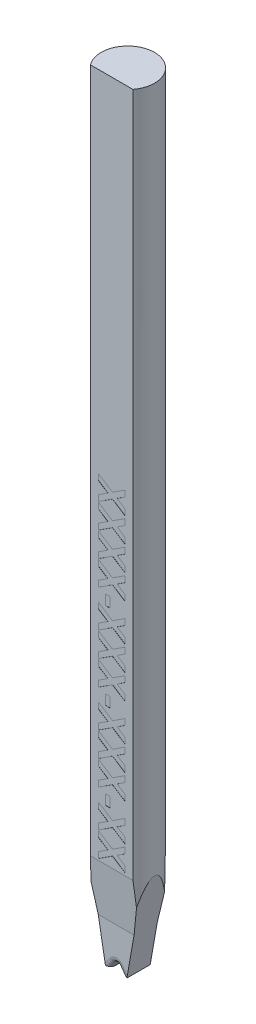
from build123d import *

# Parameters (mm, degrees)
SKETCH_TL_CUTTING_R       = 0.99695
TL_CUTTING_DEPTH          = 29.0068
SKETCH_TDF_GRINDING_W     = 2.0139
SKETCH_TDF_GRINDING_H     = 2.0139
TDF_GRINDING_DEPTH        = 30.041044486
SKETCH_ENGRAVING_W        = 0.166666667
SKETCH_ENGRAVING_H        = 0.371794872
ENGRAVING_DEPTH           = 0.005
VW_VR_GRINDING_DEPTH      = 1.00695
VW_VR_GRINDING_DEPTH_BACK = 1.00695
ISA_GRINDING_DEPTH        = 1.00695
ISA_GRINDING_DEPTH_BACK   = 1.00695
PRE_FRX_BRX_DEPTH         = 1.00695
PRE_FRX_BRX_DEPTH_BACK    = 1.00695
SKETCH_PRE_FRX_BRX_W      = 0.57134
SKETCH_PRE_FRX_BRX_H      = 1.524
FR_EDM_R                  = 0.20066
BR_EDM_R                  = 0.20066
FA_BA_GRINDING_DEPTH      = 1.00695
FA_BA_GRINDING_DEPTH_BACK = 1.00695


with BuildPart() as part:
    # sketch_TL_cutting → TL_cutting (new body)
    with BuildSketch(Plane(origin=(0, 0, 0), x_dir=(1, 0, 0), z_dir=(0, 1, 0))):
        with Locations(Location((0, 0, 0), (0, 0, 270))):
            Circle(SKETCH_TL_CUTTING_R)
    extrude(amount=TL_CUTTING_DEPTH)

    # sketch_TDF_grinding → TDF_grinding (cut, through all)
    with BuildSketch(Plane(origin=(0, 0, 0), x_dir=(1, 0, 0), z_dir=(0, 1, 0))):
        with Locations((0, -1.6102)):
            Rectangle(SKETCH_TDF_GRINDING_W, SKETCH_TDF_GRINDING_H)
    extrude(amount=TDF_GRINDING_DEPTH, mode=Mode.SUBTRACT)

    # sketch_engraving → engraving (cut)
    with BuildSketch(Plane.XY.offset(0.60325)):
        Polygon((-0.5, 15.947329744), (0.029647436, 15.604581346), (0.5, 15.908868205), (0.5, 15.68410859), (0.203325321, 15.492201538), (0.5, 15.300294487), (0.5, 15.075534872), (0.029647436, 15.379821731), (-0.5, 15.037073333), (-0.5, 15.261832949), (-0.144030449, 15.492201538), (-0.5, 15.722570128), align=None)
        Polygon((-0.5, 15.024252821), (0.029647436, 14.681504423), (0.5, 14.985791282), (0.5, 14.761031667), (0.203325321, 14.569124615), (0.5, 14.377217564), (0.5, 14.152457949), (0.029647436, 14.456744808), (-0.5, 14.11399641), (-0.5, 14.338756026), (-0.144030449, 14.569124615), (-0.5, 14.799493205), align=None)
        Polygon((-0.5, 14.101175897), (0.029647436, 13.7584275), (0.5, 14.062714359), (0.5, 13.837954744), (0.203325321, 13.646047692), (0.5, 13.454140641), (0.5, 13.229381026), (0.029647436, 13.533667885), (-0.5, 13.190919487), (-0.5, 13.415679103), (-0.144030449, 13.646047692), (-0.5, 13.876416282), align=None)
        Polygon((-0.5, 13.178098974), (0.029647436, 12.835350577), (0.5, 13.139637436), (0.5, 12.914877821), (0.203325321, 12.722970769), (0.5, 12.531063718), (0.5, 12.306304103), (0.029647436, 12.610590962), (-0.5, 12.267842564), (-0.5, 12.492602179), (-0.144030449, 12.722970769), (-0.5, 12.953339359), align=None)
        with Locations((-0.147435898, 11.998611795)):
            Rectangle(SKETCH_ENGRAVING_W, SKETCH_ENGRAVING_H)
        Polygon((-0.5, 11.79348359), (0.029647436, 11.450735192), (0.5, 11.755022051), (0.5, 11.530262436), (0.203325321, 11.338355385), (0.5, 11.146448333), (0.5, 10.921688718), (0.029647436, 11.225975577), (-0.5, 10.883227179), (-0.5, 11.107986795), (-0.144030449, 11.338355385), (-0.5, 11.568723974), align=None)
        Polygon((-0.5, 10.870406667), (0.029647436, 10.527658269), (0.5, 10.831945128), (0.5, 10.607185513), (0.203325321, 10.415278462), (0.5, 10.22337141), (0.5, 9.998611795), (0.029647436, 10.302898654), (-0.5, 9.960150256), (-0.5, 10.184909872), (-0.144030449, 10.415278462), (-0.5, 10.645647051), align=None)
        Polygon((-0.5, 9.947329744), (0.029647436, 9.604581346), (0.5, 9.908868205), (0.5, 9.68410859), (0.203325321, 9.492201538), (0.5, 9.300294487), (0.5, 9.075534872), (0.029647436, 9.379821731), (-0.5, 9.037073333), (-0.5, 9.261832949), (-0.144030449, 9.492201538), (-0.5, 9.722570128), align=None)
        with Locations((-0.147435898, 8.767842564)):
            Rectangle(SKETCH_ENGRAVING_W, SKETCH_ENGRAVING_H)
        Polygon((-0.5, 8.562714359), (0.029647436, 8.219965962), (0.5, 8.524252821), (0.5, 8.299493205), (0.203325321, 8.107586154), (0.5, 7.915679103), (0.5, 7.690919487), (0.029647436, 7.995206346), (-0.5, 7.652457949), (-0.5, 7.877217564), (-0.144030449, 8.107586154), (-0.5, 8.337954744), align=None)
        Polygon((-0.5, 7.639637436), (0.029647436, 7.296889038), (0.5, 7.601175897), (0.5, 7.376416282), (0.203325321, 7.184509231), (0.5, 6.992602179), (0.5, 6.767842564), (0.029647436, 7.072129423), (-0.5, 6.729381026), (-0.5, 6.954140641), (-0.144030449, 7.184509231), (-0.5, 7.414877821), align=None)
        Polygon((-0.5, 6.716560513), (0.029647436, 6.373812115), (0.5, 6.678098974), (0.5, 6.453339359), (0.203325321, 6.261432308), (0.5, 6.069525256), (0.5, 5.844765641), (0.029647436, 6.1490525), (-0.5, 5.806304103), (-0.5, 6.031063718), (-0.144030449, 6.261432308), (-0.5, 6.491800897), align=None)
        with Locations((-0.147435898, 5.537073333)):
            Rectangle(SKETCH_ENGRAVING_W, SKETCH_ENGRAVING_H)
        Polygon((-0.5, 5.331945128), (0.029647436, 4.989196731), (0.5, 5.29348359), (0.5, 5.068723974), (0.203325321, 4.876816923), (0.5, 4.684909872), (0.5, 4.460150256), (0.029647436, 4.764437115), (-0.5, 4.421688718), (-0.5, 4.646448333), (-0.144030449, 4.876816923), (-0.5, 5.107185513), align=None)
        Polygon((-0.5, 4.408868205), (0.029647436, 4.066119808), (0.5, 4.370406667), (0.5, 4.145647051), (0.203325321, 3.95374), (0.5, 3.761832949), (0.5, 3.537073333), (0.029647436, 3.841360192), (-0.5, 3.498611795), (-0.5, 3.72337141), (-0.144030449, 3.95374), (-0.5, 4.18410859), align=None)
    extrude(amount=-ENGRAVING_DEPTH, mode=Mode.SUBTRACT)

    # sketch_VW_VR_grinding → VW_VR_grinding (cut, two sides: drawn at the far end of the back side and taken through both)
    with BuildSketch(Plane.XY.offset(-VW_VR_GRINDING_DEPTH_BACK)):
        with BuildLine():
            Line((-0.99195, -0.01), (-0.99195, 1.509))
            ThreePointArc((-0.99195, 1.509), (-0.993414466, 1.512535534), (-0.99695, 1.514))
            Line((-0.99695, 1.514), (-1.00695, 1.514))
            Line((-1.00695, 1.514), (-1.00695, -0.01))
            Line((-1.00695, -0.01), (-0.99195, -0.01))
        make_face()
        with BuildLine():
            Line((0.99195, -0.01), (0.99195, 1.509))
            ThreePointArc((0.99195, 1.509), (0.993414466, 1.512535534), (0.99695, 1.514))
            Line((0.99695, 1.514), (1.00695, 1.514))
            Line((1.00695, 1.514), (1.00695, -0.01))
            Line((1.00695, -0.01), (0.99195, -0.01))
        make_face()
    extrude(amount=VW_VR_GRINDING_DEPTH + VW_VR_GRINDING_DEPTH_BACK, mode=Mode.SUBTRACT)

    # sketch_ISA_grinding → ISA_grinding (cut, two sides: drawn at the far end of the back side and taken through both)
    with BuildSketch(Plane.XY.offset(-ISA_GRINDING_DEPTH_BACK)):
        Polygon((-0.40005, 0), (-1.00695, 3.441900936), (-1.00695, -0.01), (1.00695, -0.01), (1.00695, 3.441900936), (0.40005, 0), align=None)
    extrude(amount=ISA_GRINDING_DEPTH + ISA_GRINDING_DEPTH_BACK, mode=Mode.SUBTRACT)

    # sketch_pre_FRX_BRX → pre_FRX_BRX (cut, two sides: drawn at the far end of the back side and taken through both)
    with BuildSketch(Plane(origin=(0, 0, 0), x_dir=(0, 0, -1), z_dir=(1, 0, 0)).offset(-PRE_FRX_BRX_DEPTH_BACK)):
        with Locations((-0.72128, 0.752)):
            Rectangle(SKETCH_PRE_FRX_BRX_W, SKETCH_PRE_FRX_BRX_H)
        with Locations((0.72128, 0.752)):
            Rectangle(SKETCH_PRE_FRX_BRX_W, SKETCH_PRE_FRX_BRX_H)
    extrude(amount=PRE_FRX_BRX_DEPTH + PRE_FRX_BRX_DEPTH_BACK, mode=Mode.SUBTRACT)

    # V-Groove_EDM: sweep along a path in sketch_contour_V-Groove
    with BuildLine(Plane(origin=(0, 0, 0), x_dir=(0, 0, -1), z_dir=(1, 0, 0))) as v_groove_edm_path:
        Line((-0.60325, 0.254), (0, 0.254))
        Line((0, 0.254), (0.99695, 0.254))
    # sketch_section_V-Groove → V-Groove_EDM (sweep, cut)
    with BuildSketch(Plane.XY.offset(0.60325)):
        with BuildLine():
            Line((-1.998237147, -2.54), (-0.065865638, 0.219712519))
            ThreePointArc((-0.065865638, 0.219712519), (0, 0.254), (0.065865638, 0.219712519))
            Line((0.065865638, 0.219712519), (1.998237147, -2.54))
            Line((1.998237147, -2.54), (-1.998237147, -2.54))
        make_face()
    sweep(path=v_groove_edm_path.line, mode=Mode.SUBTRACT)

    # FR_EDM
    fr_edm_edges = [part.edges().sort_by_distance(p)[0] for p in [
        (0.142787819, 0.10985626, 0.43561),
        (0, 0.254, 0.43561),
        (-0.142787819, 0.10985626, 0.43561),
    ]]
    fillet(fr_edm_edges, radius=FR_EDM_R)

    # BR_EDM
    br_edm_edges = [part.edges().sort_by_distance(p)[0] for p in [
        (0.142787819, 0.10985626, -0.43561),
        (0, 0.254, -0.43561),
        (-0.142787819, 0.10985626, -0.43561),
    ]]
    fillet(br_edm_edges, radius=BR_EDM_R)

    # sketch_FA_BA_grinding → FA_BA_grinding (cut, two sides: drawn at the far end of the back side and taken through both)
    with BuildSketch(Plane(origin=(0, 0, 0), x_dir=(0, 0, -1), z_dir=(1, 0, 0)).offset(-FA_BA_GRINDING_DEPTH_BACK)):
        Polygon((1.99695, 19.370197862), (1.99695, -0.1), (0.43561, -0.1), (0.43561, 1.524), align=None)
        Polygon((-2.281582645, 22.623563881), (-0.43561, 1.524), (-0.43561, -0.1), (-2.281582645, -0.1), align=None)
    extrude(amount=FA_BA_GRINDING_DEPTH + FA_BA_GRINDING_DEPTH_BACK, mode=Mode.SUBTRACT)


solid = part.part
